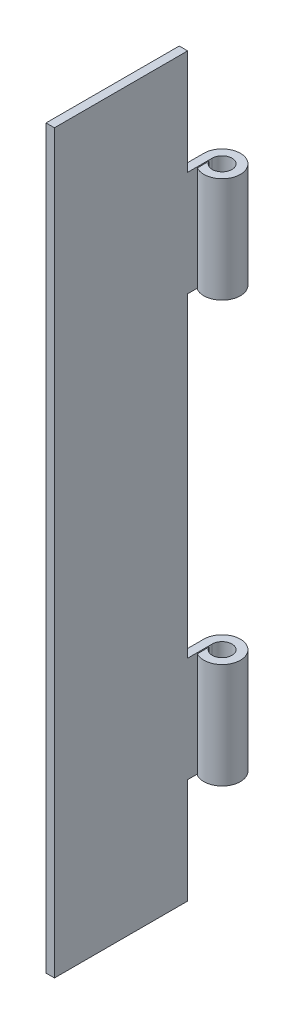
from build123d import *

# Parameters (mm, degrees)
BOSS_EXTRUDE2_DEPTH = 88.9
SKETCH8_W           = 5.93725
SKETCH8_H           = 12.7
CUT_EXTRUDE3_DEPTH  = 92.025212307
SKETCH10_W          = 5.93725
SKETCH10_H          = 12.7
CUT_EXTRUDE4_DEPTH  = 92.025212307


with BuildPart() as part:
    # Sketch4 → Boss-Extrude2 (new body)
    with BuildSketch(Plane(origin=(0, 0, 0), x_dir=(1, 0, 0), z_dir=(0, 1, 0))):
        with BuildLine():
            Line((0, 0), (0, -19.05))
            Line((0, -19.05), (1.016, -19.05))
            Line((1.016, -19.05), (1.016, 0))
            ThreePointArc((1.016, 0), (3.365064987, 0.274963066), (1.143, -0.535060511))
            Line((1.143, -0.535060511), (1.143, -1.933363843))
            ThreePointArc((1.143, -1.933363843), (4.106126962, 1.122980938), (0, 0))
        make_face()
    extrude(amount=BOSS_EXTRUDE2_DEPTH)

    # Sketch8 → Cut-Extrude3 (cut, through all)
    with BuildSketch(Plane(origin=(0, 0, 0), x_dir=(0, 0, -1), z_dir=(1, 0, 0))):
        with Locations((0, 6.35)):
            Rectangle(SKETCH8_W, SKETCH8_H)
        with Locations((0, 31.75)):
            Rectangle(SKETCH8_W, SKETCH8_H)
        with Locations((0, 57.15)):
            Rectangle(SKETCH8_W, SKETCH8_H)
        with Locations((0, 82.55)):
            Rectangle(SKETCH8_W, SKETCH8_H)
    extrude(amount=CUT_EXTRUDE3_DEPTH, mode=Mode.SUBTRACT)

    # Sketch10 → Cut-Extrude4 (cut, through all)
    with BuildSketch(Plane(origin=(0, 0, 0), x_dir=(0, 0, -1), z_dir=(1, 0, 0))):
        with Locations((0, 44.45)):
            Rectangle(SKETCH10_W, SKETCH10_H)
    extrude(amount=CUT_EXTRUDE4_DEPTH, mode=Mode.SUBTRACT)


solid = part.part
